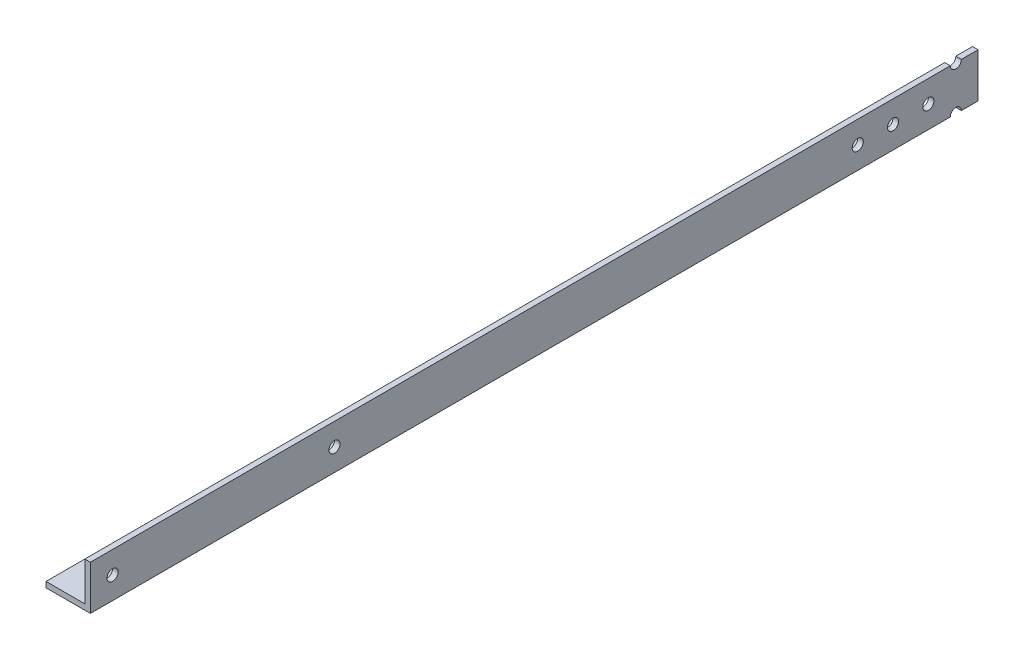
from build123d import *

# Parameters (mm, degrees)
EXTRUDE1_DEPTH     = 254
SKETCH2_R          = 1.5875
EXTRUDE2_DEPTH     = 1.5875
SKETCH3_R          = 1.5875
CUT_EXTRUDE3_DEPTH = 255.634208228
SKETCH5_W          = 11.1125
SKETCH5_H          = 12.7
CUT_EXTRUDE4_DEPTH = 1.5875
SKETCH6_R          = 1.5875
CUT_EXTRUDE5_DEPTH = 1.5875
SKETCH7_R          = 1.5875
CUT_EXTRUDE6_DEPTH = 1.5875


with BuildPart() as part:
    # Sketch1 → Extrude1 (new body)
    with BuildSketch(Plane.XY):
        Polygon((0, 0), (0, 12.7), (-1.5875, 12.7), (-1.5875, 1.5875), (-12.7, 1.5875), (-12.7, 0), align=None)
    extrude(amount=EXTRUDE1_DEPTH)

    # Sketch2 → Extrude2 (cut)
    with BuildSketch(Plane(origin=(0, 0, 0), x_dir=(0, 0, -1), z_dir=(1, 0, 0))):
        with Locations((-247.65, 6.35)):
            Circle(SKETCH2_R)
        with Locations((-184.15, 6.35)):
            Circle(SKETCH2_R)
    extrude(amount=-EXTRUDE2_DEPTH, mode=Mode.SUBTRACT)

    # Sketch3 → Cut-Extrude3 (cut, through all)
    with BuildSketch(Plane(origin=(0, 0, 0), x_dir=(0, 0, -1), z_dir=(1, 0, 0))):
        with Locations((-24.310512242, 6.35)):
            Circle(SKETCH3_R)
        with Locations((-14.207724106, 6.35)):
            Circle(SKETCH3_R)
    extrude(amount=-CUT_EXTRUDE3_DEPTH, mode=Mode.SUBTRACT)

    # Sketch5 → Cut-Extrude4 (cut)
    with BuildSketch(Plane(origin=(0, 1.5875, 0), x_dir=(1, 0, 0), z_dir=(0, 1, 0))):
        with Locations((-7.14375, -6.35)):
            Rectangle(SKETCH5_W, SKETCH5_H)
    extrude(amount=-CUT_EXTRUDE4_DEPTH, mode=Mode.SUBTRACT)

    # Sketch6 → Cut-Extrude5 (cut)
    with BuildSketch(Plane(origin=(0, 0, 0), x_dir=(0, 0, -1), z_dir=(1, 0, 0))):
        with Locations((-6.35, 12.7)):
            Circle(SKETCH6_R)
        with Locations((-6.35, 0)):
            Circle(SKETCH6_R)
    extrude(amount=-CUT_EXTRUDE5_DEPTH, mode=Mode.SUBTRACT)

    # Sketch7 → Cut-Extrude6 (cut)
    with BuildSketch(Plane(origin=(0, 0, 0), x_dir=(0, 0, -1), z_dir=(1, 0, 0))):
        with Locations((-34.413300378, 6.35)):
            Circle(SKETCH7_R)
    extrude(amount=-CUT_EXTRUDE6_DEPTH, mode=Mode.SUBTRACT)


solid = part.part
